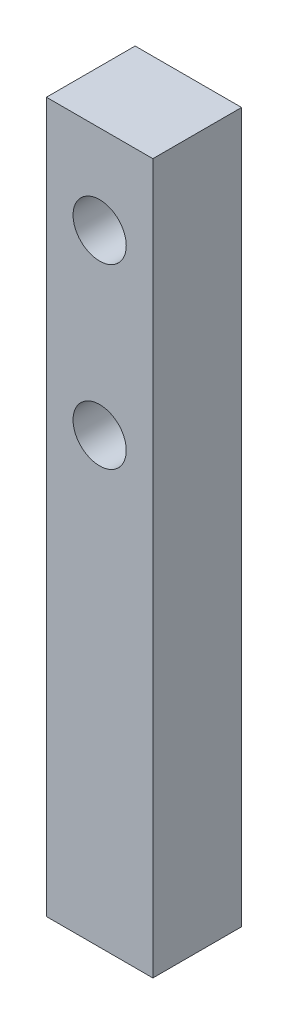
from build123d import *

# Parameters (mm, degrees)
SKETCH1_W           = 7.62
SKETCH1_H           = 50.8
SKETCH1_R           = 1.905
BOSS_EXTRUDE1_DEPTH = 6.35


with BuildPart() as part:
    # Sketch1 → Boss-Extrude1 (new body)
    with BuildSketch(Plane.XY):
        with Locations((3.81, 25.4)):
            Rectangle(SKETCH1_W, SKETCH1_H)
        with Locations((3.81, 44.45)):
            Circle(SKETCH1_R, mode=Mode.SUBTRACT)
        with Locations((3.81, 31.75)):
            Circle(SKETCH1_R, mode=Mode.SUBTRACT)
    extrude(amount=BOSS_EXTRUDE1_DEPTH)


solid = part.part
